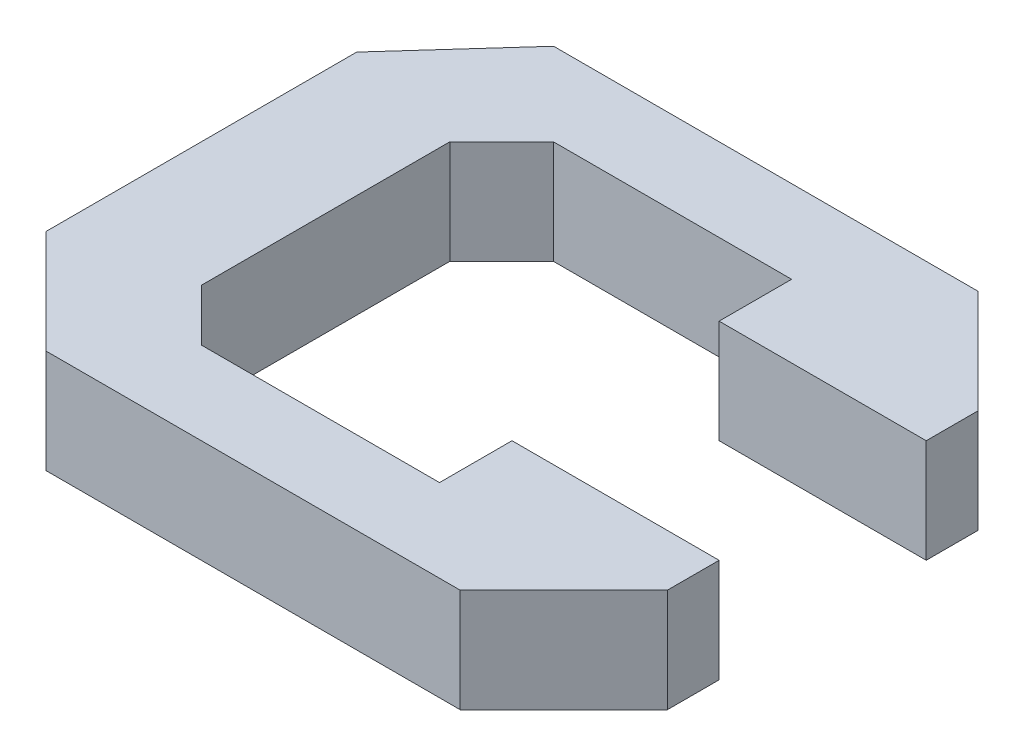
from build123d import *

# Parameters (mm, degrees)
SKETCH1_W           = 38.1
SKETCH1_H           = 31.75
BOSS_EXTRUDE1_DEPTH = 6.35
SKETCH2_W           = 12.7
SKETCH2_H           = 12.7
CUT_EXTRUDE1_DEPTH  = 50.99995


with BuildPart() as part:
    # Sketch1 → Boss-Extrude1 (new body)
    with BuildSketch(Plane(origin=(0, 0, 0), x_dir=(1, 0, 0), z_dir=(0, 1, 0))):
        with Locations((-19.05, 15.875)):
            Rectangle(SKETCH1_W, SKETCH1_H)
    extrude(amount=BOSS_EXTRUDE1_DEPTH)

    # Sketch2 → Cut-Extrude1 (cut, through all)
    with BuildSketch(Plane(origin=(0, 6.35, 0), x_dir=(1, 0, 0), z_dir=(0, 1, 0))):
        Polygon((-12.7, 26.67), (-27.305, 26.67), (-30.48, 23.495), (-30.48, 8.255), (-27.305, 5.08), (-12.7, 5.08), (-12.7, 9.525), (-12.7, 22.225), align=None)
        with Locations((-6.35, 15.875)):
            Rectangle(SKETCH2_W, SKETCH2_H)
        Polygon((0, 0), (0, 6.35), (-6.35, 0), align=None)
        Polygon((0, 31.75), (-6.35, 31.75), (0, 25.4), align=None)
        Polygon((-38.1, 6.35), (-31.75, 0), (-38.1, 0), align=None)
        Polygon((-38.1, 31.75), (-38.1, 25.4), (-32.371620034, 31.75), align=None)
    extrude(amount=-CUT_EXTRUDE1_DEPTH, mode=Mode.SUBTRACT)


solid = part.part
